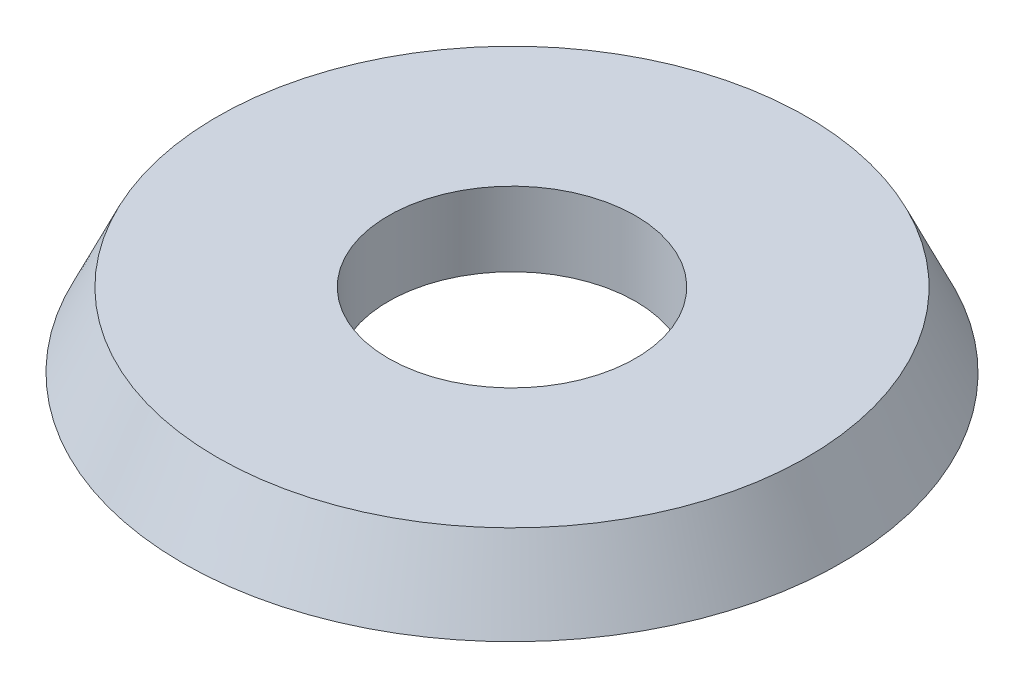
from build123d import *


with BuildPart() as part:
    # Sketch1 → Revolve1 (revolve)
    with BuildSketch(Plane.XY, mode=Mode.PRIVATE) as revolve1_sk:
        Polygon((-7.5, 0), (-7.5, 4.5), (-17.9, 4.5), (-20, 0), align=None)
    revolve(revolve1_sk.sketch.rotate(Axis((0, 0, 0), (0, -1, 0)), 270), axis=Axis((0, 0, 0), (0, -1, 0)))


solid = part.part
